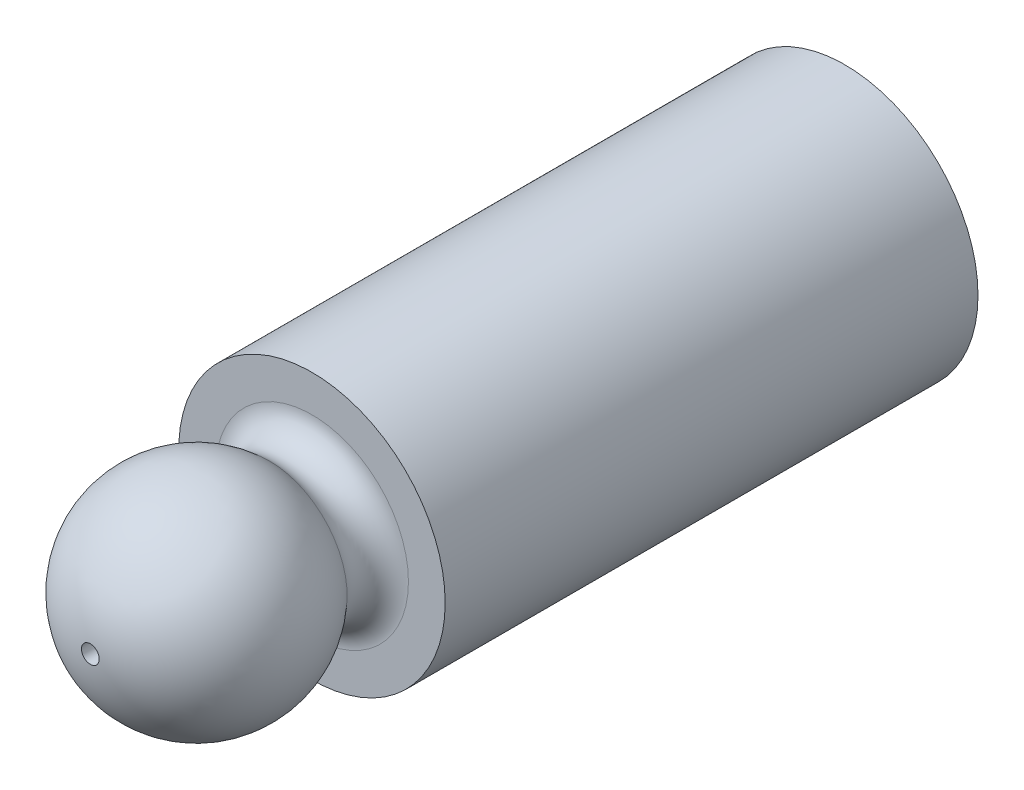
from build123d import *

# Parameters (mm, degrees)
SKETCH_1_R          = 7.5
EXTRUDE_1_DEPTH     = 30
F_10_0MM_1_D        = 10
F_10_0MM_1_DEPTH    = 25
F_10_0MM_1_TIP      = 3.004303095
F_2_0MM_1_D         = 2
F_2_0MM_1_DEPTH     = 37
F_2_0MM_1_TIP       = 0.600860619
SKETCH_8_R          = 0.5
CUT_EXTRUDE_1_DEPTH = 44.80353867


with BuildPart() as part:
    # 草图1 → 凸台-拉伸1 (new body)
    with BuildSketch(Plane.XY):
        Circle(SKETCH_1_R)
    extrude(amount=EXTRUDE_1_DEPTH)

    # 草图2 → 旋转1 (revolve)
    with BuildSketch(Plane(origin=(0, 0, 0), x_dir=(0, 0, -1), z_dir=(1, 0, 0))):
        with BuildLine():
            Line((-30, 0), (-30, 5.431390246))
            ThreePointArc((-30, 5.431390246), (-30.860121025, 4.119849947), (-32.405787349, 4.386048651))
            ThreePointArc((-32.405787349, 4.386048651), (-38.891100593, 5.502966287), (-42.5, 0))
            Line((-42.5, 0), (-30, 0))
        make_face()
    revolve(axis=Axis((0, 0, 30), (0, 0, 1)))

    # Ø10.0mm 暗销孔1
    with Locations(Plane(origin=(0, 0, 0), x_dir=(-1, 0, 0), z_dir=(0, 0, -1))):
        with Locations((0, 0)):
            Hole(F_10_0MM_1_D / 2, depth=F_10_0MM_1_DEPTH)
            with Locations((0, 0, -(F_10_0MM_1_DEPTH + F_10_0MM_1_TIP / 2))):  # 118° drill point
                Cone(0, F_10_0MM_1_D / 2, F_10_0MM_1_TIP, mode=Mode.SUBTRACT)

    # Ø2.0mm 暗销孔1
    with Locations(Plane(origin=(0, 0, 0), x_dir=(-1, 0, 0), z_dir=(0, 0, -1))):
        with Locations((0, 0)):
            Hole(F_2_0MM_1_D / 2, depth=F_2_0MM_1_DEPTH)
            with Locations((0, 0, -(F_2_0MM_1_DEPTH + F_2_0MM_1_TIP / 2))):  # 118° drill point
                Cone(0, F_2_0MM_1_D / 2, F_2_0MM_1_TIP, mode=Mode.SUBTRACT)

    # 草图8 → 切除-拉伸1 (cut, through all)
    with BuildSketch(Plane(origin=(0, 0, 0), x_dir=(-1, 0, 0), z_dir=(0, 0, -1))):
        Circle(SKETCH_8_R)
    extrude(amount=-CUT_EXTRUDE_1_DEPTH, mode=Mode.SUBTRACT)


solid = part.part
